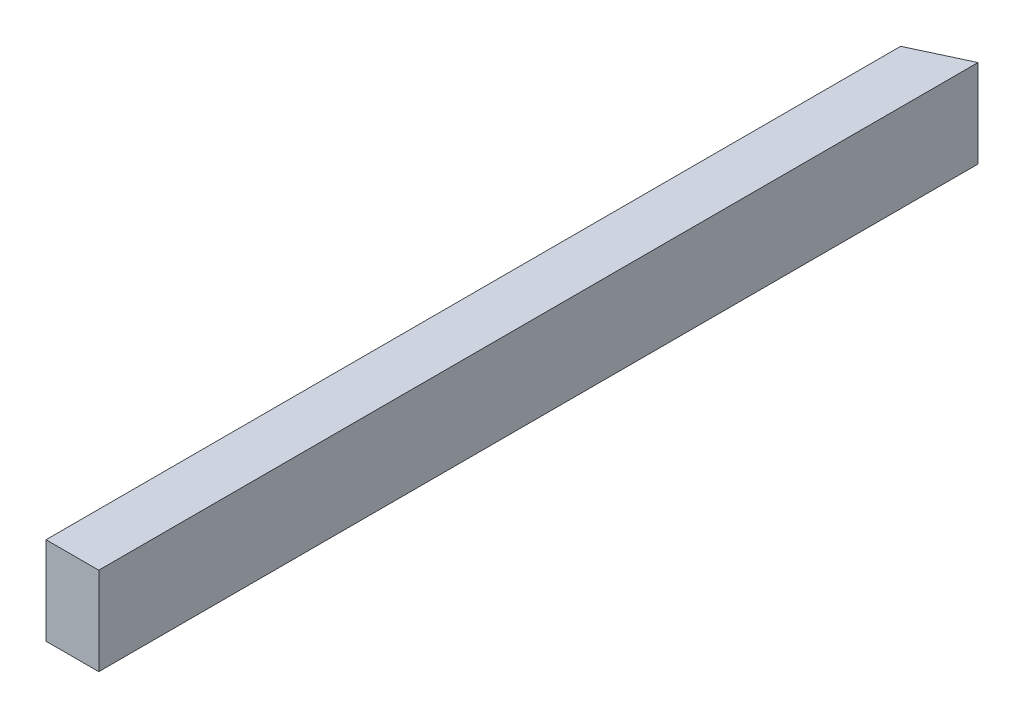
from build123d import *

# Parameters (mm, degrees)
BOSS_EXTRUDE1_DEPTH = 5


with BuildPart() as part:
    # Sketch1 → Boss-Extrude1 (new body)
    with BuildSketch(Plane(origin=(0, 0, 0), x_dir=(1, 0, 0), z_dir=(0, 1, 0))):
        Polygon((-25.858718727, 19.036772542), (-28.858718727, 17.637849567), (-28.858718727, -30.963227458), (-25.858718727, -30.963227458), align=None)
    extrude(amount=BOSS_EXTRUDE1_DEPTH)


solid = part.part
